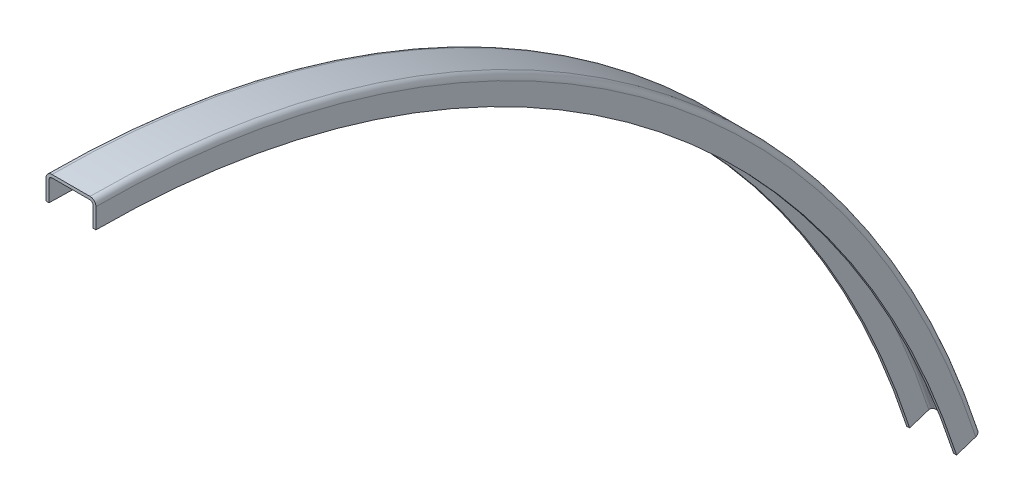
from build123d import *

# Parameters (mm, degrees)
REVOLVE1_ANGLE = 72


with BuildPart() as part:
    # Sketch1 → Revolve1 (revolve)
    with BuildSketch(Plane.XY):
        with BuildLine():
            ThreePointArc((-52.157480315, 97.330708661), (-49.814334564, 102.987562911), (-44.157480315, 105.330708661))
            Line((-44.157480315, 105.330708661), (6.842519685, 105.330708661))
            ThreePointArc((6.842519685, 105.330708661), (12.499373935, 102.987562911), (14.842519685, 97.330708661))
            Line((14.842519685, 97.330708661), (14.842519685, 70.330708661))
            Line((14.842519685, 70.330708661), (10.842519685, 70.330708661))
            Line((10.842519685, 70.330708661), (10.842519685, 97.330708661))
            ThreePointArc((10.842519685, 97.330708661), (9.67094681, 100.159135786), (6.842519685, 101.330708661))
            Line((6.842519685, 101.330708661), (-44.157480315, 101.330708661))
            ThreePointArc((-44.157480315, 101.330708661), (-46.98590744, 100.159135786), (-48.157480315, 97.330708661))
            Line((-48.157480315, 97.330708661), (-48.157480315, 70.330708661))
            Line((-48.157480315, 70.330708661), (-52.157480315, 70.330708661))
            Line((-52.157480315, 70.330708661), (-52.157480315, 97.330708661))
        make_face()
    revolve(axis=Axis((14.842519685, -1144.669291339, 0), (-1, 0, 0)), revolution_arc=REVOLVE1_ANGLE)


solid = part.part
